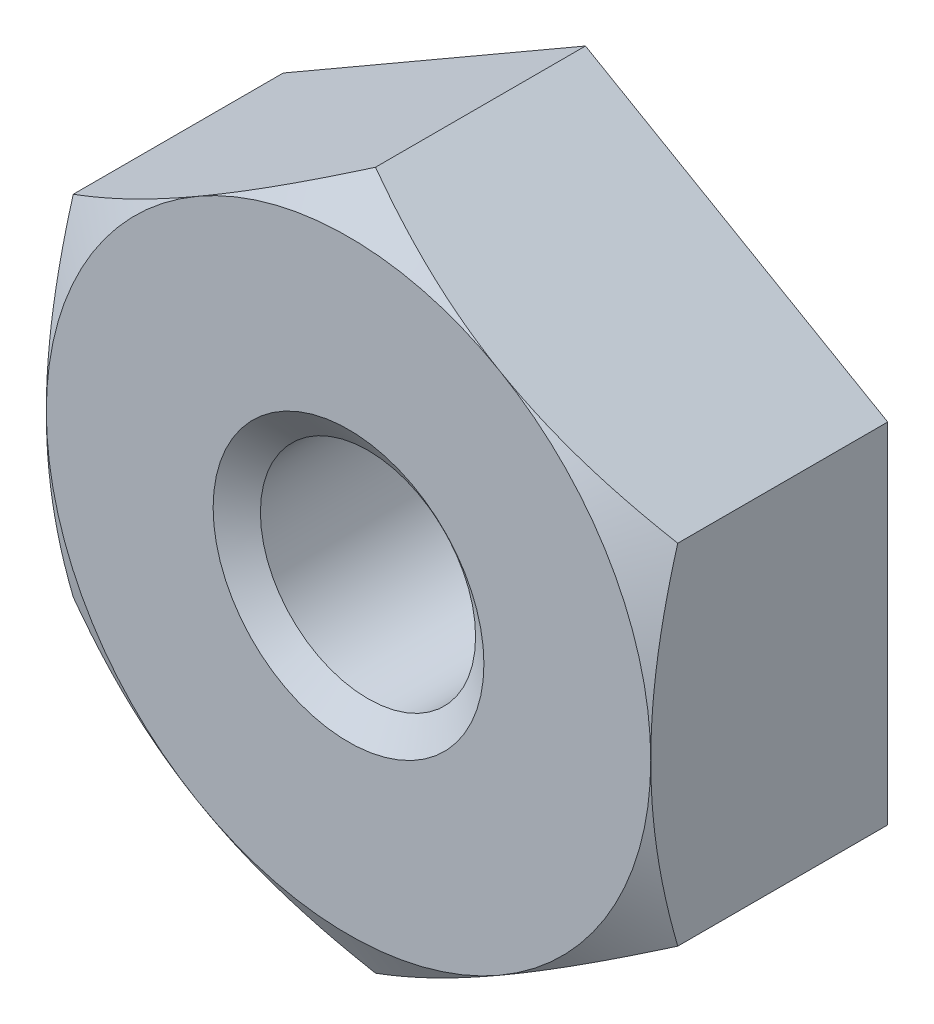
from build123d import *

# Parameters (mm, degrees)
BASENUT_START = -2.4892
BASENUTSKE_R  = 1.1303
BASENUT_DEPTH = 2.4892


with BuildPart() as part:
    # BaseNutSke → BaseNut (new body)
    with BuildSketch(Plane.XY.offset(BASENUT_START)):
        Polygon((3.175, 1.833087105), (3.175, -1.833087105), (0, -3.666174209), (-3.175, -1.833087105), (-3.175, 1.833087105), (0, 3.666174209), align=None)
        Circle(BASENUTSKE_R, mode=Mode.SUBTRACT)
    extrude(amount=BASENUT_DEPTH)

    # Sketch4 → Single-Chamfer (revolve, cut)
    with BuildSketch(Plane(origin=(0, 0, 0), x_dir=(0, 0, -1), z_dir=(1, 0, 0))):
        Polygon((0, 3.175), (-12.7, 3.175), (-12.7, 16.366174209), (0.283579562, 16.366174209), (0.283579562, 3.666174209), align=None)
    revolve(axis=Axis((0, 0, 0), (0, 0, -1)), mode=Mode.SUBTRACT)

    # EndChamferSketch → EndChamfer (revolve, cut)
    with BuildSketch(Plane(origin=(0, 0, 0), x_dir=(0, 0, -1), z_dir=(1, 0, 0)), mode=Mode.PRIVATE) as endchamfer_sk:
        Polygon((2.4638, 1.4224), (2.238816316, 1.10109), (2.5146, 1.10109), (2.5146, 1.4224), align=None)
        Polygon((-0.0508, 1.4224), (0, 1.4224), (0.224983684, 1.10109), (-0.0508, 1.10109), align=None)
    revolve(endchamfer_sk.sketch.rotate(Axis((0, 0, -25.037505729), (0, 0, -1)), 90), axis=Axis((0, 0, -25.037505729), (0, 0, -1)), mode=Mode.SUBTRACT)


solid = part.part
